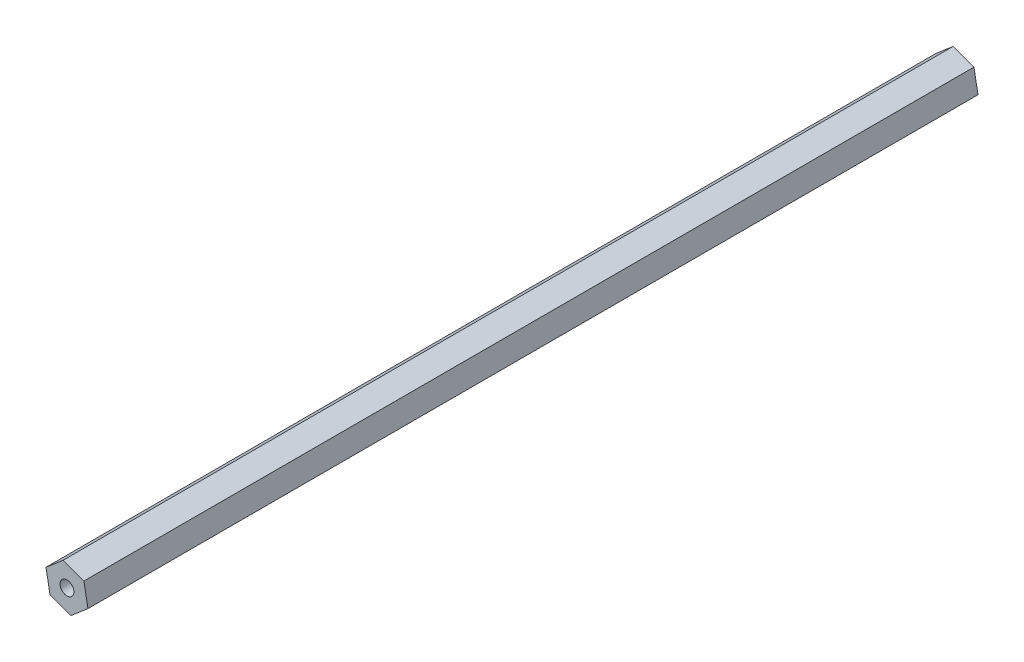
from build123d import *

# Parameters (mm, degrees)
BOSS_EXTRUDE1_DEPTH = 160
SKETCH4_R           = 1.25
CUT_EXTRUDE1_DEPTH  = 5


with BuildPart() as part:
    # Sketch1 → Boss-Extrude1 (new body)
    with BuildSketch(Plane.XY):
        Polygon((3.770690633, -1.334875333), (3.041381265, 2.598076211), (-0.729309367, 3.932951544), (-3.770690633, 1.334875333), (-3.041381265, -2.598076211), (0.729309367, -3.932951544), align=None)
    extrude(amount=BOSS_EXTRUDE1_DEPTH)

    # Sketch4 → Cut-Extrude1 (cut)
    with BuildSketch(Plane(origin=(0, 0, 0), x_dir=(-1, 0, 0), z_dir=(0, 0, -1))):
        Circle(SKETCH4_R)
    cut_extrude1 = extrude(amount=-CUT_EXTRUDE1_DEPTH, mode=Mode.SUBTRACT)

    # Mirror1: Cut-Extrude1 across plane
    add(cut_extrude1.mirror(Plane.XY.offset(80)), mode=Mode.SUBTRACT)


solid = part.part
